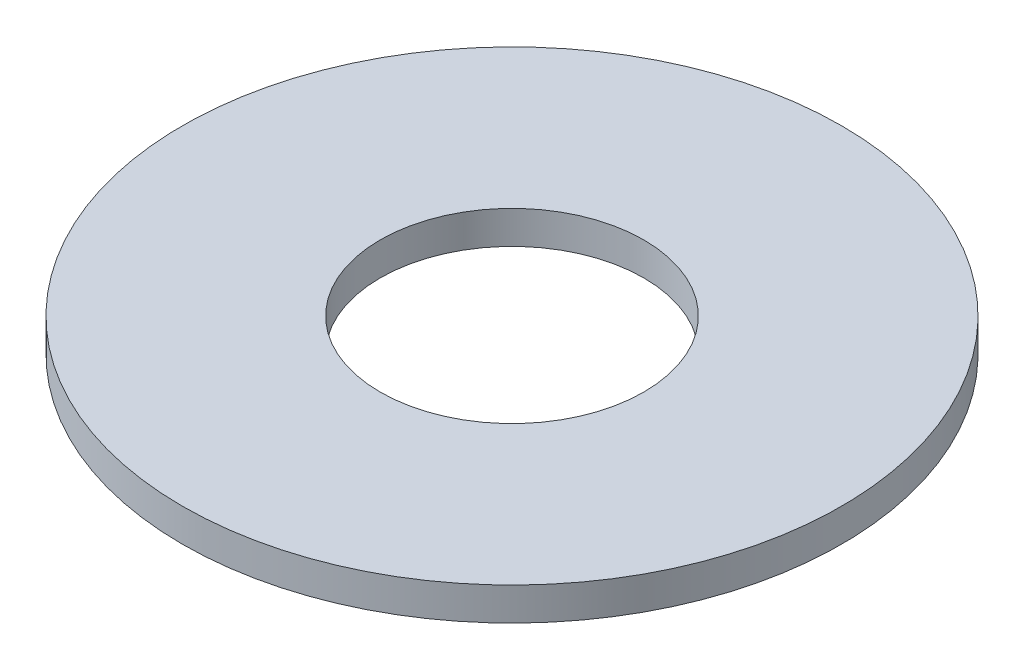
from build123d import *

# Parameters (mm, degrees)
SKETCH_1_R      = 5
SKETCH_1_R_2    = 2
EXTRUDE_1_DEPTH = 0.5


with BuildPart() as part:
    # 草图1 → 凸台-拉伸1 (new body)
    with BuildSketch(Plane(origin=(0, 0, 0), x_dir=(1, 0, 0), z_dir=(0, 1, 0))):
        with Locations(Location((0, 0, 0), (0, 0, 270))):
            Circle(SKETCH_1_R)
        with Locations(Location((0, 0, 0), (0, 0, 270))):
            Circle(SKETCH_1_R_2, mode=Mode.SUBTRACT)
    extrude(amount=EXTRUDE_1_DEPTH)


solid = part.part
